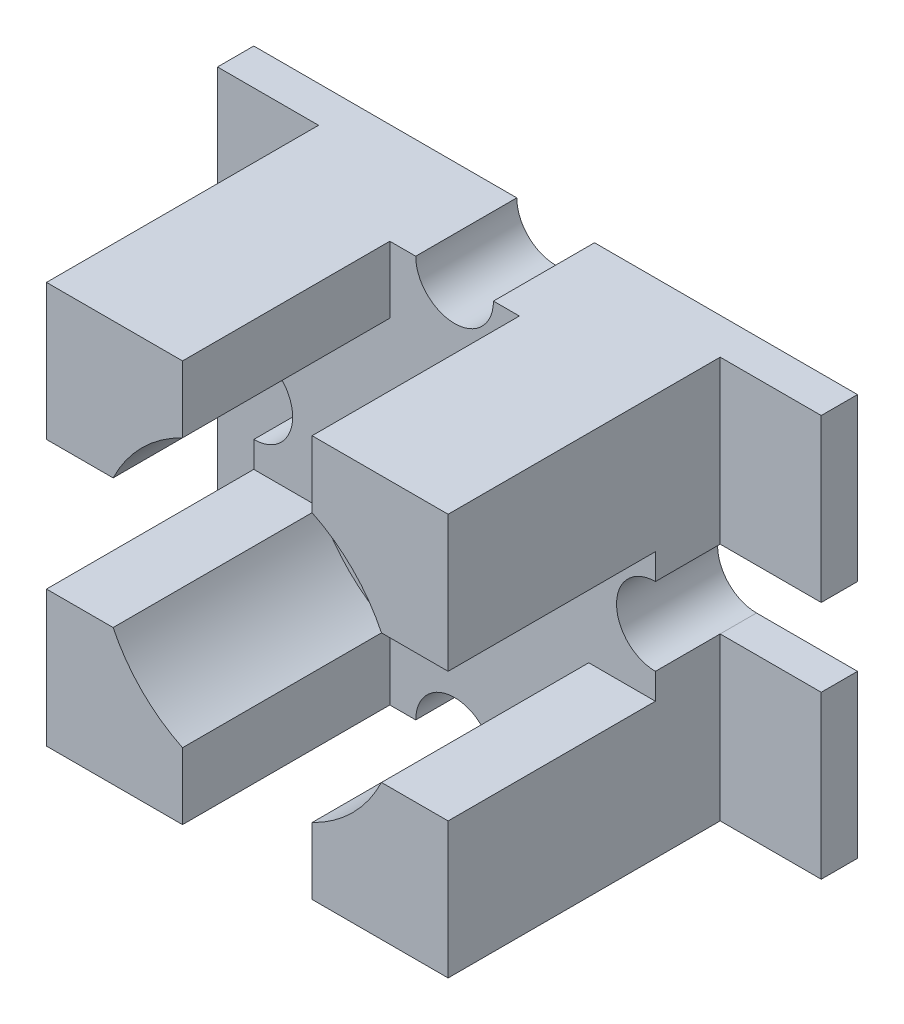
from build123d import *

# Parameters (mm, degrees)
SKETCH1_W               = 23.3
SKETCH1_H               = 15.5
BOSS_EXTRUDE1_DEPTH     = 3
SKETCH2_W               = 15.5
SKETCH2_H               = 15.5
BOSS_EXTRUDE2_DEPTH     = 10.5
CUT_EXTRUDE1_DEPTH      = 8
CUT_EXTRUDE2_DEPTH      = 10
CUT_EXTRUDE2_DEPTH_BACK = 3
SKETCH4_R               = 1.5
SKETCH5_W               = 35.704226427
SKETCH5_H               = 23.298790068
CUT_EXTRUDE3_DEPTH      = 1.6


with BuildPart() as part:
    # Sketch1 → Boss-Extrude1 (new body)
    with BuildSketch(Plane.XY):
        Rectangle(SKETCH1_W, SKETCH1_H)
    extrude(amount=BOSS_EXTRUDE1_DEPTH)

    # Sketch2 → Boss-Extrude2 (add)
    with BuildSketch(Plane.XY.offset(3)):
        Rectangle(SKETCH2_W, SKETCH2_H)
    extrude(amount=BOSS_EXTRUDE2_DEPTH)

    # Sketch3 → Cut-Extrude1 (cut)
    with BuildSketch(Plane.XY.offset(13.5)):
        with BuildLine():
            Line((-2.5, 4.304165553), (-2.5, 5.178078794))
            ThreePointArc((-2.5, 5.178078794), (-4.065863992, 4.065863992), (-5.178078794, 2.5))
            Line((-5.178078794, 2.5), (-5.178078794, -2.5))
            ThreePointArc((-5.178078794, -2.5), (-4.065863992, -4.065863992), (-2.5, -5.178078794))
            Line((-2.5, -5.178078794), (-2.5, -3.82452247))
            Line((-2.5, -3.82452247), (2.5, -3.82452247))
            Line((2.5, -3.82452247), (2.5, -5.178078794))
            ThreePointArc((2.5, -5.178078794), (4.065863992, -4.065863992), (5.178078794, -2.5))
            Line((5.178078794, -2.5), (3.988610893, -2.5))
            Line((3.988610893, -2.5), (3.988610893, 2.5))
            Line((3.988610893, 2.5), (5.178078794, 2.5))
            ThreePointArc((5.178078794, 2.5), (4.065863992, 4.065863992), (2.5, 5.178078794))
            Line((2.5, 5.178078794), (2.5, 4.304165553))
            Line((2.5, 4.304165553), (-2.5, 4.304165553))
        make_face()
        with BuildLine():
            Line((-5.178078794, -2.5), (-5.178078794, 2.5))
            ThreePointArc((-5.178078794, 2.5), (-5.75, 0), (-5.178078794, -2.5))
        make_face()
        with BuildLine():
            ThreePointArc((-5.178078794, -2.5), (-5.75, 0), (-5.178078794, 2.5))
            Line((-5.178078794, 2.5), (-7.75, 2.5))
            Line((-7.75, 2.5), (-7.75, -2.5))
            Line((-7.75, -2.5), (-5.178078794, -2.5))
        make_face()
        with BuildLine():
            ThreePointArc((2.5, 5.178078794), (0, 5.75), (-2.5, 5.178078794))
            Line((-2.5, 5.178078794), (-2.5, 4.304165553))
            Line((-2.5, 4.304165553), (2.5, 4.304165553))
            Line((2.5, 4.304165553), (2.5, 5.178078794))
        make_face()
        with BuildLine():
            Line((2.5, 7.75), (-2.5, 7.75))
            Line((-2.5, 7.75), (-2.5, 5.178078794))
            ThreePointArc((-2.5, 5.178078794), (0, 5.75), (2.5, 5.178078794))
            Line((2.5, 5.178078794), (2.5, 7.75))
        make_face()
        with BuildLine():
            Line((7.75, 2.5), (5.178078794, 2.5))
            ThreePointArc((5.178078794, 2.5), (5.605196387, 1.28229227), (5.75, 0))
            ThreePointArc((5.75, 0), (5.605196387, -1.28229227), (5.178078794, -2.5))
            Line((5.178078794, -2.5), (7.75, -2.5))
            Line((7.75, -2.5), (7.75, 2.5))
        make_face()
        with BuildLine():
            ThreePointArc((5.75, 0), (5.605196387, 1.28229227), (5.178078794, 2.5))
            Line((5.178078794, 2.5), (3.988610893, 2.5))
            Line((3.988610893, 2.5), (3.988610893, -2.5))
            Line((3.988610893, -2.5), (5.178078794, -2.5))
            ThreePointArc((5.178078794, -2.5), (5.605196387, -1.28229227), (5.75, 0))
        make_face()
        with BuildLine():
            Line((-2.5, -3.82452247), (-2.5, -5.178078794))
            ThreePointArc((-2.5, -5.178078794), (0, -5.75), (2.5, -5.178078794))
            Line((2.5, -5.178078794), (2.5, -3.82452247))
            Line((2.5, -3.82452247), (-2.5, -3.82452247))
        make_face()
        with BuildLine():
            ThreePointArc((2.5, -5.178078794), (0, -5.75), (-2.5, -5.178078794))
            Line((-2.5, -5.178078794), (-2.5, -7.75))
            Line((-2.5, -7.75), (2.5, -7.75))
            Line((2.5, -7.75), (2.5, -5.178078794))
        make_face()
    extrude(amount=-CUT_EXTRUDE1_DEPTH, mode=Mode.SUBTRACT)

    # Sketch4 → Cut-Extrude2 (cut, two sides: drawn at the far end of the back side and taken through both)
    with BuildSketch(Plane.XY.offset(3).offset(-CUT_EXTRUDE2_DEPTH_BACK)):
        with Locations((0, 7.75)):
            Circle(SKETCH4_R)
        with Locations((7.75, 0)):
            Circle(SKETCH4_R)
        with BuildLine():
            Line((11.65, 1.5), (7.75, 1.5))
            ThreePointArc((7.75, 1.5), (8.810660172, 1.060660172), (9.25, 0))
            ThreePointArc((9.25, 0), (8.810660172, -1.060660172), (7.75, -1.5))
            Line((7.75, -1.5), (11.65, -1.5))
            Line((11.65, -1.5), (11.65, 1.5))
        make_face()
        with BuildLine():
            ThreePointArc((-7.75, -1.5), (-9.25, 0), (-7.75, 1.5))
            Line((-7.75, 1.5), (-11.65, 1.5))
            Line((-11.65, 1.5), (-11.65, -1.5))
            Line((-11.65, -1.5), (-7.75, -1.5))
        make_face()
        with BuildLine():
            Line((-7.75, -1.5), (-7.75, 1.5))
            ThreePointArc((-7.75, 1.5), (-9.25, 0), (-7.75, -1.5))
        make_face()
        with BuildLine():
            ThreePointArc((-6.25, 0), (-6.689339828, 1.060660172), (-7.75, 1.5))
            Line((-7.75, 1.5), (-7.75, -1.5))
            ThreePointArc((-7.75, -1.5), (-6.689339828, -1.060660172), (-6.25, 0))
        make_face()
        with Locations((0, -7.75)):
            Circle(SKETCH4_R)
    extrude(amount=CUT_EXTRUDE2_DEPTH + CUT_EXTRUDE2_DEPTH_BACK, mode=Mode.SUBTRACT)

    # Sketch5 → Cut-Extrude3 (cut)
    with BuildSketch(Plane(origin=(0, 0, 0), x_dir=(-1, 0, 0), z_dir=(0, 0, -1))):
        with Locations((1.840090656, -1.042081913)):
            Rectangle(SKETCH5_W, SKETCH5_H)
    extrude(amount=-CUT_EXTRUDE3_DEPTH, mode=Mode.SUBTRACT)


solid = part.part
